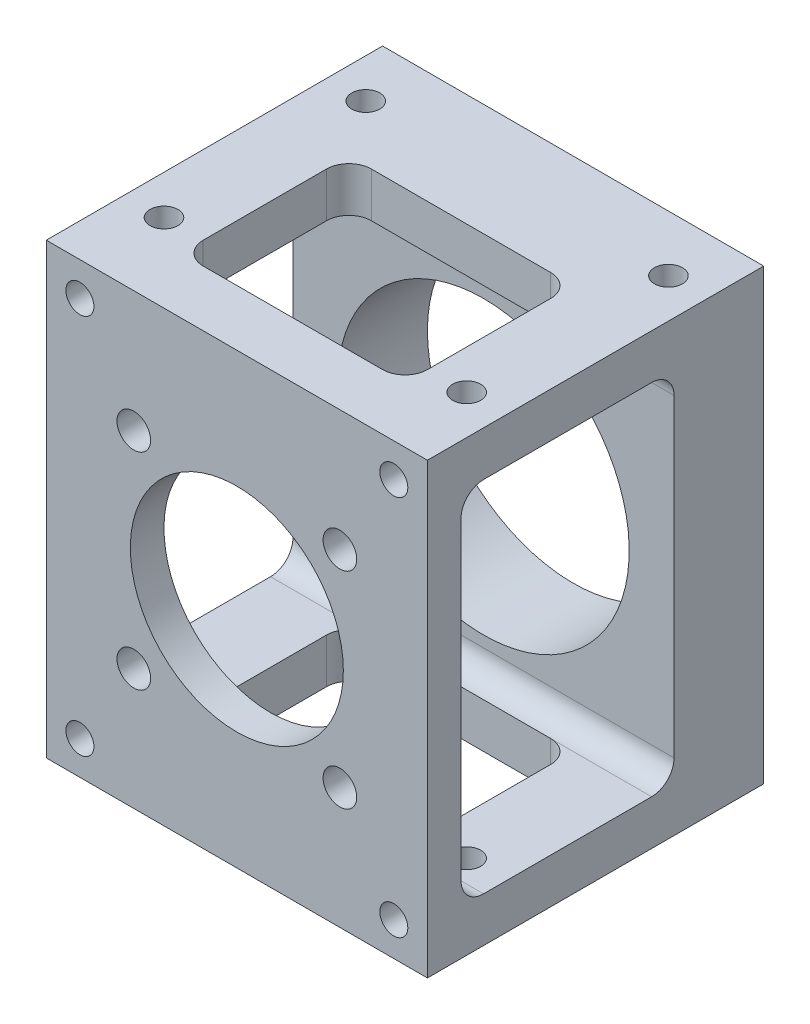
from build123d import *

# Parameters (mm, degrees)
SKETCH_1_W                = 34
SKETCH_1_H                = 40
SKETCH_1_R                = 9.5
EXTRUDE_1_DEPTH           = 30
SKETCH_3_W                = 19
SKETCH_3_H                = 32
CUT_EXTRUDE_1_DEPTH       = 61.464865831
FILLET_3_R                = 2
HOLE_WIZARD_M3_2_D        = 2.5
HOLE_WIZARD_M3_2_DEPTH    = 4
HOLE_WIZARD_M3_2_TIP      = 0.751075774
HOLE_WIZARD_M3_4_D        = 2.5
HOLE_WIZARD_M3_4_DEPTH    = 4
HOLE_WIZARD_M3_4_TIP      = 0.751075774
SKETCH_18_W               = 20
SKETCH_18_H               = 15
CUT_EXTRUDE_8_DEPTH       = 61.464865831
SKETCH_12_R               = 13
CUT_EXTRUDE_6_DEPTH       = 8
HOLE_WIZARD_3_0_3_1_D     = 3
HOLE_WIZARD_3_0_3_1_DEPTH = 3
FILLET_7_R                = 2
HOLE_WIZARD_M3_3_D        = 2.5
HOLE_WIZARD_M3_3_DEPTH    = 4
HOLE_WIZARD_M3_3_TIP      = 0.751075774


with BuildPart() as part:
    # 草图1 → 凸台-拉伸1 (new body)
    with BuildSketch(Plane.XY):
        with Locations((17, 20)):
            Rectangle(SKETCH_1_W, SKETCH_1_H)
        with Locations((17, 20)):
            Circle(SKETCH_1_R, mode=Mode.SUBTRACT)
    extrude(amount=EXTRUDE_1_DEPTH)

    # 草图3 → 切除-拉伸1 (cut, through all)
    with BuildSketch(Plane.ZY):
        with Locations((17.5, 20)):
            Rectangle(SKETCH_3_W, SKETCH_3_H)
    extrude(amount=-CUT_EXTRUDE_1_DEPTH, mode=Mode.SUBTRACT)

    # 圆角3
    fillet_3_edges = [part.edges().sort_by_distance(p)[0] for p in [
        (17, 36, 27),
        (17, 4, 27),
        (17, 4, 8),
        (17, 36, 8),
    ]]
    fillet(fillet_3_edges, radius=FILLET_3_R)

    # M3 螺纹孔2
    with Locations(Plane(origin=(3.5, 40, 5), x_dir=(0, 0, 1), z_dir=(0, 1, 0))):
        with Locations((0, 0), (0, 27), (18, 27), (18, 0)):
            Hole(HOLE_WIZARD_M3_2_D / 2, depth=HOLE_WIZARD_M3_2_DEPTH)
            with Locations((0, 0, -(HOLE_WIZARD_M3_2_DEPTH + HOLE_WIZARD_M3_2_TIP / 2))):  # 118° drill point
                Cone(0, HOLE_WIZARD_M3_2_D / 2, HOLE_WIZARD_M3_2_TIP, mode=Mode.SUBTRACT)

    # M3 螺纹孔4
    with Locations(Plane(origin=(3.5, 0, 5), x_dir=(0, 0, -1), z_dir=(0, -1, 0))):
        with Locations((0, 0), (-18, 0), (-18, 27), (0, 27)):
            Hole(HOLE_WIZARD_M3_4_D / 2, depth=HOLE_WIZARD_M3_4_DEPTH)
            with Locations((0, 0, -(HOLE_WIZARD_M3_4_DEPTH + HOLE_WIZARD_M3_4_TIP / 2))):  # 118° drill point
                Cone(0, HOLE_WIZARD_M3_4_D / 2, HOLE_WIZARD_M3_4_TIP, mode=Mode.SUBTRACT)

    # 草图18 → 切除-拉伸8 (cut, through all)
    with BuildSketch(Plane(origin=(0, 40, 0), x_dir=(1, 0, 0), z_dir=(0, 1, 0))):
        with Locations((17, -17.5)):
            Rectangle(SKETCH_18_W, SKETCH_18_H)
    extrude(amount=-CUT_EXTRUDE_8_DEPTH, mode=Mode.SUBTRACT)

    # 草图12 → 切除-拉伸6 (cut)
    with BuildSketch(Plane(origin=(0, 0, 0), x_dir=(-1, 0, 0), z_dir=(0, 0, -1))):
        with Locations((-17, 20)):
            Circle(SKETCH_12_R)
    extrude(amount=-CUT_EXTRUDE_6_DEPTH, mode=Mode.SUBTRACT)

    # Ø3.0 (3) 直径孔1
    with Locations(Plane(origin=(7.807611845, 29.192388155, 30), x_dir=(1, 0, 0), z_dir=(0, 0, 1))):
        with Locations((0, 0), (18.38477631, 0), (18.38477631, -18.38477631), (0, -18.38477631)):
            Hole(HOLE_WIZARD_3_0_3_1_D / 2, depth=HOLE_WIZARD_3_0_3_1_DEPTH)

    # 圆角7
    fillet_7_edges = [part.edges().sort_by_distance(p)[0] for p in [
        (27, 38, 25),
        (27, 2, 25),
        (27, 2, 10),
        (27, 38, 10),
        (7, 2, 25),
        (7, 38, 25),
        (7, 38, 10),
        (7, 2, 10),
    ]]
    fillet(fillet_7_edges, radius=FILLET_7_R)

    # M3 螺纹孔3
    with Locations(Plane(origin=(3, 37, 30), x_dir=(1, 0, 0), z_dir=(0, 0, 1))):
        with Locations((0, 0), (28, 0), (28, -34), (0, -34)):
            Hole(HOLE_WIZARD_M3_3_D / 2, depth=HOLE_WIZARD_M3_3_DEPTH)
            with Locations((0, 0, -(HOLE_WIZARD_M3_3_DEPTH + HOLE_WIZARD_M3_3_TIP / 2))):  # 118° drill point
                Cone(0, HOLE_WIZARD_M3_3_D / 2, HOLE_WIZARD_M3_3_TIP, mode=Mode.SUBTRACT)


solid = part.part
